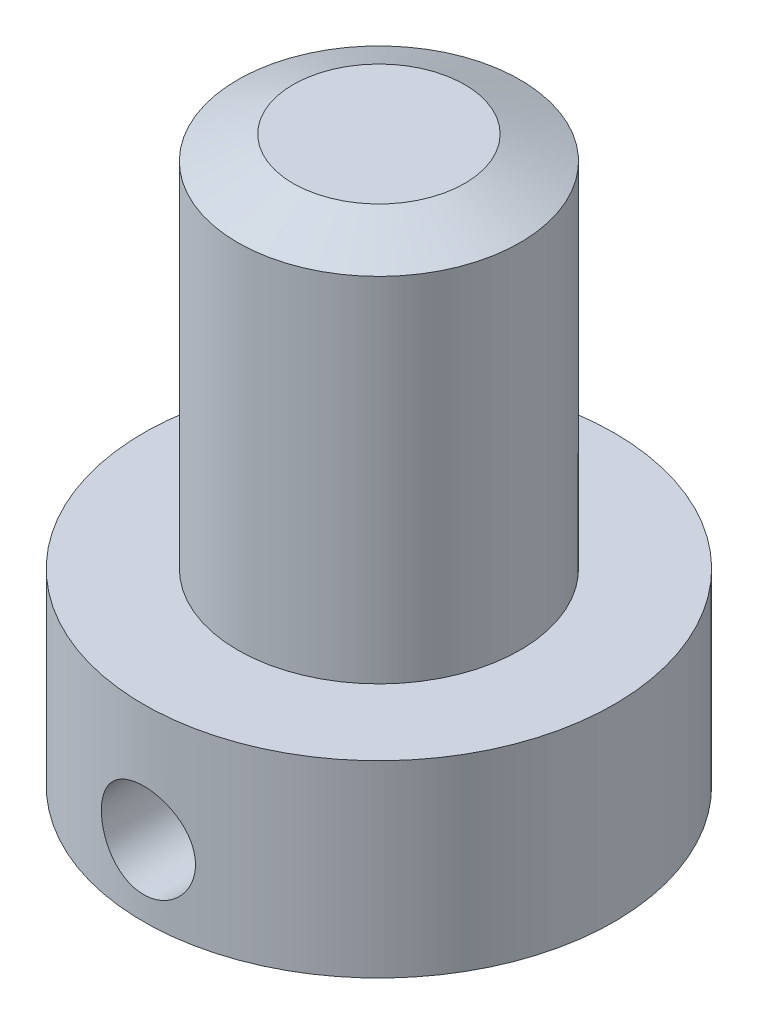
from build123d import *

# Parameters (mm, degrees)
SKETCH1_R               = 3
BOSS_EXTRUDE1_DEPTH     = 8
SKETCH2_R               = 5
BOSS_EXTRUDE2_DEPTH     = 5
CUT_EXTRUDE1_DEPTH      = 11.677078252
CUT_EXTRUDE1_DEPTH_BACK = 11.677078252
SKETCH3_R               = 1
CHAMFER1_SIZE           = 1
CHAMFER1_SIZE2          = 2.355852366
CHAMFER2_SIZE           = 0.5
CHAMFER2_SIZE2          = 1.177926183


with BuildPart() as part:
    # Sketch1 → Boss-Extrude1 (new body)
    with BuildSketch(Plane(origin=(0, 0, 0), x_dir=(1, 0, 0), z_dir=(0, 1, 0))):
        with Locations(Location((0, 0, 0), (0, 0, 270))):
            Circle(SKETCH1_R)
    extrude(amount=BOSS_EXTRUDE1_DEPTH)

    # Sketch2 → Boss-Extrude2 (add)
    with BuildSketch(Plane.XZ):
        with Locations(Location((0, 0, 0), (0, 0, 270))):
            Circle(SKETCH2_R)
    extrude(amount=BOSS_EXTRUDE2_DEPTH)

    # Sketch3 → Cut-Extrude1 (cut, two sides: drawn at the far end of the back side and taken through both)
    with BuildSketch(Plane.XY.offset(-CUT_EXTRUDE1_DEPTH_BACK)):
        with Locations(Location((0, -2.5, 0), (0, 0, 270))):
            Circle(SKETCH3_R)
    extrude(amount=CUT_EXTRUDE1_DEPTH + CUT_EXTRUDE1_DEPTH_BACK, mode=Mode.SUBTRACT)

    # Chamfer1
    chamfer1_edges = [part.edges().sort_by_distance(p)[0] for p in [
        (0, -5, 5),
    ]]
    chamfer1_side = [part.faces().sort_by_distance(p)[0] for p in [
        (0, -2.5, 5),
    ]]
    chamfer(chamfer1_edges, length=CHAMFER1_SIZE, length2=CHAMFER1_SIZE2, reference=chamfer1_side[0])

    # Chamfer2
    chamfer2_edges = [part.edges().sort_by_distance(p)[0] for p in [
        (0, 8, -3),
    ]]
    chamfer2_side = [part.faces().sort_by_distance(p)[0] for p in [
        (0, 4, -3),
    ]]
    chamfer(chamfer2_edges, length=CHAMFER2_SIZE, length2=CHAMFER2_SIZE2, reference=chamfer2_side[0])


solid = part.part
